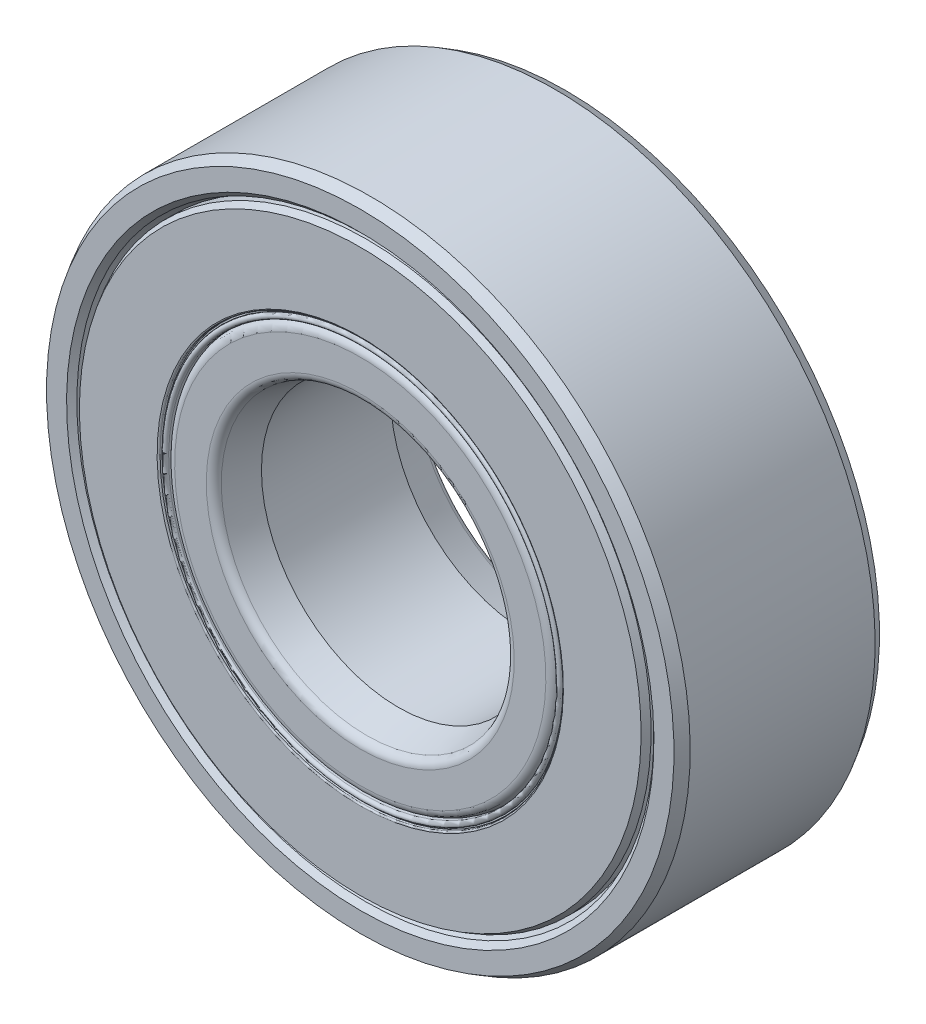
from build123d import *

# Parameters (mm, degrees)
CIRPATTERN1_COUNT = 8


with BuildPart() as part:
    # Sketch3 → Revolve1 (revolve)
    with BuildSketch(Plane(origin=(0, 0, 0), x_dir=(0, 0, -1), z_dir=(1, 0, 0)), mode=Mode.PRIVATE) as revolve1_sk:
        with BuildLine():
            Line((-3.005710104, 9.890125), (-3.39328125, 10.031189361))
            Line((-3.39328125, 10.031189361), (-3.571875, 10.209783111))
            Line((-3.571875, 10.209783111), (-3.571875, 10.906277701))
            Line((-3.571875, 10.906277701), (-3.2146875, 11.1125))
            Line((-3.2146875, 11.1125), (3.2146875, 11.1125))
            Line((3.2146875, 11.1125), (3.571875, 10.906277701))
            Line((3.571875, 10.906277701), (3.571875, 10.209783111))
            Line((3.571875, 10.209783111), (3.39328125, 10.031189361))
            Line((3.39328125, 10.031189361), (3.005710104, 9.890125))
            Line((3.005710104, 9.890125), (1.793586198, 9.890125))
            ThreePointArc((1.793586198, 9.890125), (0, 10.705041667), (-1.793586198, 9.890125))
            Line((-1.793586198, 9.890125), (-3.005710104, 9.890125))
        make_face()
    revolve(revolve1_sk.sketch.rotate(Axis((0, 0, 3.571875), (0, 0, -1)), 180), axis=Axis((0, 0, 3.571875), (0, 0, -1)))


with BuildPart() as body_2:
    # Sketch4 → Revolve2 (revolve)
    with BuildSketch(Plane(origin=(0, 0, 0), x_dir=(0, 0, -1), z_dir=(1, 0, 0)), mode=Mode.PRIVATE) as revolve2_sk:
        with BuildLine():
            Line((-2.244511682, 4.7625), (-3.345505546, 5.057510417))
            ThreePointArc((-3.345505546, 5.057510417), (-3.508761544, 5.166594587), (-3.571875, 5.352520833))
            Line((-3.571875, 5.352520833), (-3.571875, 6.452041076))
            ThreePointArc((-3.571875, 6.452041076), (-3.482420356, 6.66800369), (-3.266457743, 6.757458333))
            Line((-3.266457743, 6.757458333), (-1.793586198, 6.757458333))
            ThreePointArc((-1.793586198, 6.757458333), (0, 5.942541667), (1.793586198, 6.757458333))
            Line((1.793586198, 6.757458333), (3.266457743, 6.757458333))
            ThreePointArc((3.266457743, 6.757458333), (3.482420356, 6.66800369), (3.571875, 6.452041076))
            Line((3.571875, 6.452041076), (3.571875, 5.352520833))
            ThreePointArc((3.571875, 5.352520833), (3.508761544, 5.166594587), (3.345505546, 5.057510417))
            Line((3.345505546, 5.057510417), (2.244511682, 4.7625))
            Line((2.244511682, 4.7625), (-2.244511682, 4.7625))
        make_face()
    revolve(revolve2_sk.sketch.rotate(Axis((0, 0, 3.571875), (0, 0, -1)), 180), axis=Axis((0, 0, 3.571875), (0, 0, -1)))


with BuildPart() as body_3:
    # Sketch5 → Revolve3 (revolve)
    with BuildSketch(Plane(origin=(0, 0, 0), x_dir=(0, 0, -1), z_dir=(1, 0, 0))):
        with BuildLine():
            Line((-2.38125, 8.323791667), (2.38125, 8.323791667))
            ThreePointArc((2.38125, 8.323791667), (0, 10.705041667), (-2.38125, 8.323791667))
        make_face()
    revolve(axis=Axis((0, 8.323791667, 2.38125), (0, 0, -1)))


with BuildPart() as cirpattern1_1:
    # CirPattern1: pattern copy
    add(body_3.part.rotate(Axis((0, 0, 0), (0, 0, 1)), 1 * 360 / CIRPATTERN1_COUNT))


with BuildPart() as cirpattern1_2:
    # CirPattern1: pattern copy
    add(body_3.part.rotate(Axis((0, 0, 0), (0, 0, 1)), 2 * 360 / CIRPATTERN1_COUNT))


with BuildPart() as cirpattern1_3:
    # CirPattern1: pattern copy
    add(body_3.part.rotate(Axis((0, 0, 0), (0, 0, 1)), 3 * 360 / CIRPATTERN1_COUNT))


with BuildPart() as cirpattern1_4:
    # CirPattern1: pattern copy
    add(body_3.part.rotate(Axis((0, 0, 0), (0, 0, 1)), 4 * 360 / CIRPATTERN1_COUNT))


with BuildPart() as cirpattern1_5:
    # CirPattern1: pattern copy
    add(body_3.part.rotate(Axis((0, 0, 0), (0, 0, 1)), 5 * 360 / CIRPATTERN1_COUNT))


with BuildPart() as cirpattern1_6:
    # CirPattern1: pattern copy
    add(body_3.part.rotate(Axis((0, 0, 0), (0, 0, 1)), 6 * 360 / CIRPATTERN1_COUNT))


with BuildPart() as cirpattern1_7:
    # CirPattern1: pattern copy
    add(body_3.part.rotate(Axis((0, 0, 0), (0, 0, 1)), 7 * 360 / CIRPATTERN1_COUNT))


with BuildPart() as body_11:
    # Sketch6 → Revolve4 (revolve)
    with BuildSketch(Plane(origin=(0, 0, 0), x_dir=(0, 0, -1), z_dir=(1, 0, 0)), mode=Mode.PRIVATE) as revolve4_sk:
        with BuildLine():
            Line((-3.351904547, 9.890125), (-2.38125, 9.890125))
            Line((-2.38125, 9.890125), (-2.38125, 7.011458333))
            Line((-2.38125, 7.011458333), (-3.521075, 7.011458333))
            ThreePointArc((-3.521075, 7.011458333), (-3.556996024, 7.026337309), (-3.571875, 7.062258333))
            Line((-3.571875, 7.062258333), (-3.571875, 9.763125))
            Line((-3.571875, 9.763125), (-3.351904547, 9.890125))
        make_face()
        with BuildLine():
            Line((3.521075, 7.011458333), (2.38125, 7.011458333))
            Line((2.38125, 7.011458333), (2.38125, 9.890125))
            Line((2.38125, 9.890125), (3.351904547, 9.890125))
            Line((3.351904547, 9.890125), (3.571875, 9.763125))
            Line((3.571875, 9.763125), (3.571875, 7.062258333))
            ThreePointArc((3.571875, 7.062258333), (3.556996024, 7.026337309), (3.521075, 7.011458333))
        make_face()
    revolve(revolve4_sk.sketch.rotate(Axis((0, 0, 3.571875), (0, 0, -1)), 180), axis=Axis((0, 0, 3.571875), (0, 0, -1)))


with BuildPart() as body_12:
    # Sketch7 → Revolve5 (revolve)
    with BuildSketch(Plane(origin=(0, 0, 0), x_dir=(0, 0, -1), z_dir=(1, 0, 0)), mode=Mode.PRIVATE) as revolve5_sk:
        with BuildLine():
            Line((-2.38125, 7.011458333), (-3.39368053, 7.011458333))
            Line((-3.39368053, 7.011458333), (-3.456215822, 7.000431674))
            ThreePointArc((-3.456215822, 7.000431674), (-3.47796189, 6.972091647), (-3.451625, 6.947958333))
            Line((-3.451625, 6.947958333), (-3.476625, 6.947958333))
            ThreePointArc((-3.476625, 6.947958333), (-3.571875, 6.852708333), (-3.476625, 6.757458333))
            Line((-3.476625, 6.757458333), (-2.38125, 6.757458333))
            Line((-2.38125, 6.757458333), (-2.38125, 7.011458333))
        make_face()
    revolve(revolve5_sk.sketch.rotate(Axis((0, 0, 3.571875), (0, 0, -1)), 180), axis=Axis((0, 0, 3.571875), (0, 0, -1)))


solid = Compound([part.part, body_2.part, body_3.part, cirpattern1_1.part, cirpattern1_2.part, cirpattern1_3.part, cirpattern1_4.part, cirpattern1_5.part, cirpattern1_6.part, cirpattern1_7.part, body_11.part, body_12.part])
